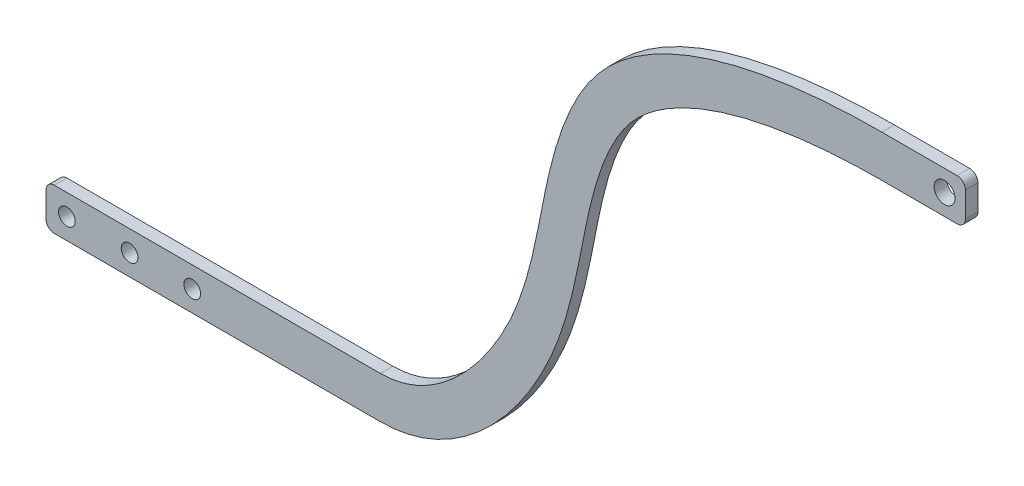
from build123d import *

# Parameters (mm, degrees)
BOSS_EXTRUDE1_DEPTH = 3
SKETCH2_R           = 2.5
CUT_EXTRUDE1_DEPTH  = 3
SKETCH3_R           = 2
CUT_EXTRUDE2_DEPTH  = 3
FILLET1_R           = 2


with BuildPart() as part:
    # Sketch1 → Boss-Extrude1 (new body)
    with BuildSketch(Plane.XY):
        with BuildLine():
            Line((0, 0), (80, 0))
            add(Edge.make_bspline(
                [(80, 0), (93.241777409, 0), (116.662532156, 26.884378871), (118.223670956, 60.684196149), (136.379625173, 104.815244744), (177.581885357, 110), (200, 110)],
                knots=[0, 0, 0, 0, 0.230202035, 0.463699787, 0.593998921, 1, 1, 1, 1], degree=3))
            Line((200, 110), (220, 110))
            Line((220, 110), (220, 100))
            Line((220, 100), (200, 100))
            add(Edge.make_bspline(
                [(80, -10), (81.338450604, -10), (84.040299899, -9.814022301), (89.171948828, -8.773431689), (95.096140774, -6.397962571), (101.320848398, -2.351077717), (108.584153804, 4.16806824), (115.951573111, 13.793209278), (122.226980389, 26.353069456), (125.834100639, 38.407840745), (128.08688028, 49.634894484), (129.760964157, 58.23912359), (131.439150703, 64.711932829), (133.475999532, 70.987795966), (136.119804102, 76.709064997), (139.295139146, 81.312488332), (142.969844702, 85.310454179), (148.880794013, 89.705284662), (157.775180444, 93.859737882), (167.976748847, 96.877377019), (177.046331544, 98.492727447), (184.331013441, 99.319764785), (189.734131763, 99.730444252), (194.116725781, 99.918312291), (197.527693678, 99.988976604), (199.170669274, 100), (200, 100)],
                knots=[0, 0, 0, 0, 0.015625, 0.03125, 0.0625, 0.09375, 0.125, 0.1875, 0.25, 0.3125, 0.375, 0.4375, 0.46875, 0.5, 0.5625, 0.59375, 0.625, 0.6875, 0.75, 0.8125, 0.875, 0.90625, 0.9375, 0.96875, 0.984375, 1, 1, 1, 1], degree=3))
            Line((80, -10), (0, -10))
            Line((0, -10), (0, 0))
        make_face()
    extrude(amount=BOSS_EXTRUDE1_DEPTH)

    # Sketch2 → Cut-Extrude1 (cut)
    with BuildSketch(Plane.XY.offset(3)):
        with Locations((215, 105)):
            Circle(SKETCH2_R)
    extrude(amount=-CUT_EXTRUDE1_DEPTH, mode=Mode.SUBTRACT)

    # Sketch3 → Cut-Extrude2 (cut)
    with BuildSketch(Plane.XY.offset(3)):
        with Locations((5, -5)):
            Circle(SKETCH3_R)
        with Locations((20, -5)):
            Circle(SKETCH3_R)
        with Locations((35, -5)):
            Circle(SKETCH3_R)
    extrude(amount=-CUT_EXTRUDE2_DEPTH, mode=Mode.SUBTRACT)

    # Fillet1
    fillet1_edges = [part.edges().sort_by_distance(p)[0] for p in [
        (0, 0, 1.5),
        (0, -10, 1.5),
        (220, 100, 1.5),
        (220, 110, 1.5),
    ]]
    fillet(fillet1_edges, radius=FILLET1_R)


solid = part.part
